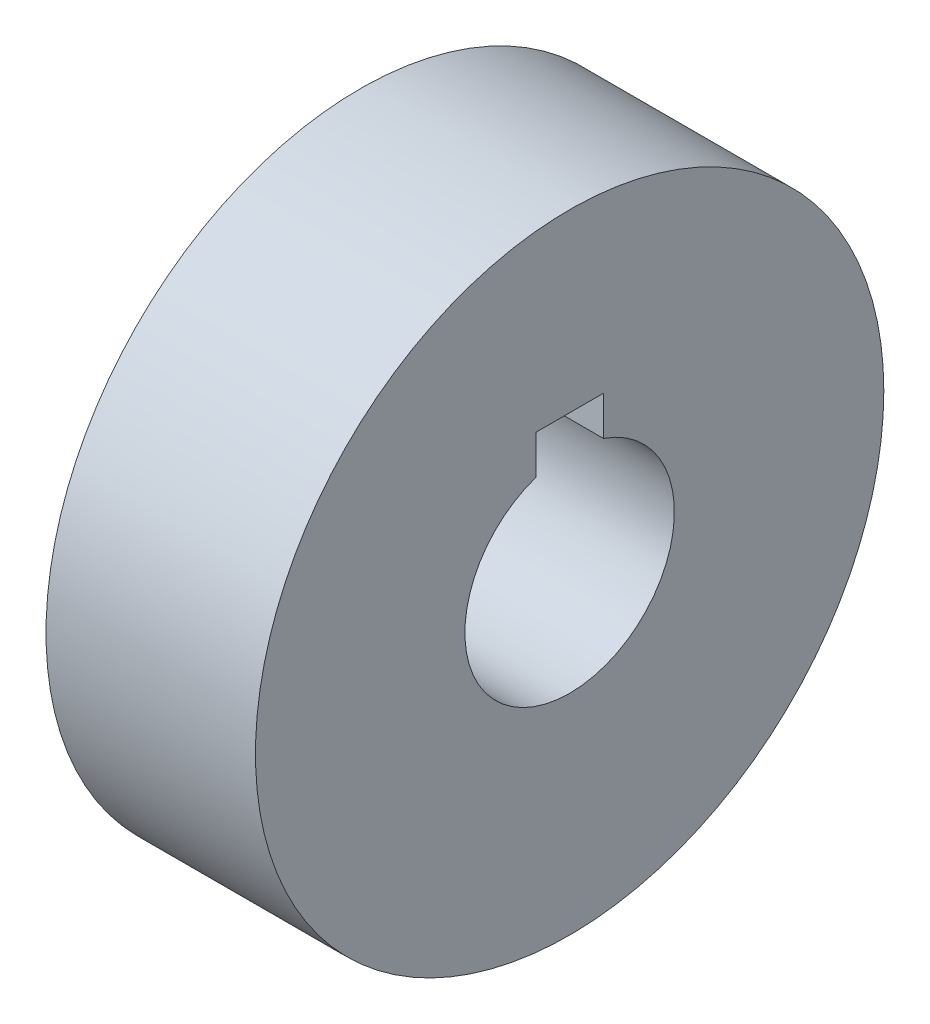
from build123d import *

# Parameters (mm, degrees)
SKETCH1_R           = 15
BOSS_EXTRUDE1_DEPTH = 10


with BuildPart() as part:
    # Sketch1 → Boss-Extrude1 (new body)
    with BuildSketch(Plane(origin=(0, 0, 0), x_dir=(0, 0, -1), z_dir=(1, 0, 0))):
        Circle(SKETCH1_R)
        with BuildLine():
            Line((1.615081939, 6.6), (1.615081939, 4.731966857))
            ThreePointArc((1.615081939, 4.731966857), (4.0666577, 2.909002433), (5, 0))
            ThreePointArc((5, 0), (-2.909002433, -4.0666577), (-1.615081939, 4.731966857))
            Line((-1.615081939, 4.731966857), (-1.615081939, 6.6))
            Line((-1.615081939, 6.6), (1.615081939, 6.6))
        make_face(mode=Mode.SUBTRACT)
    extrude(amount=BOSS_EXTRUDE1_DEPTH)


solid = part.part
